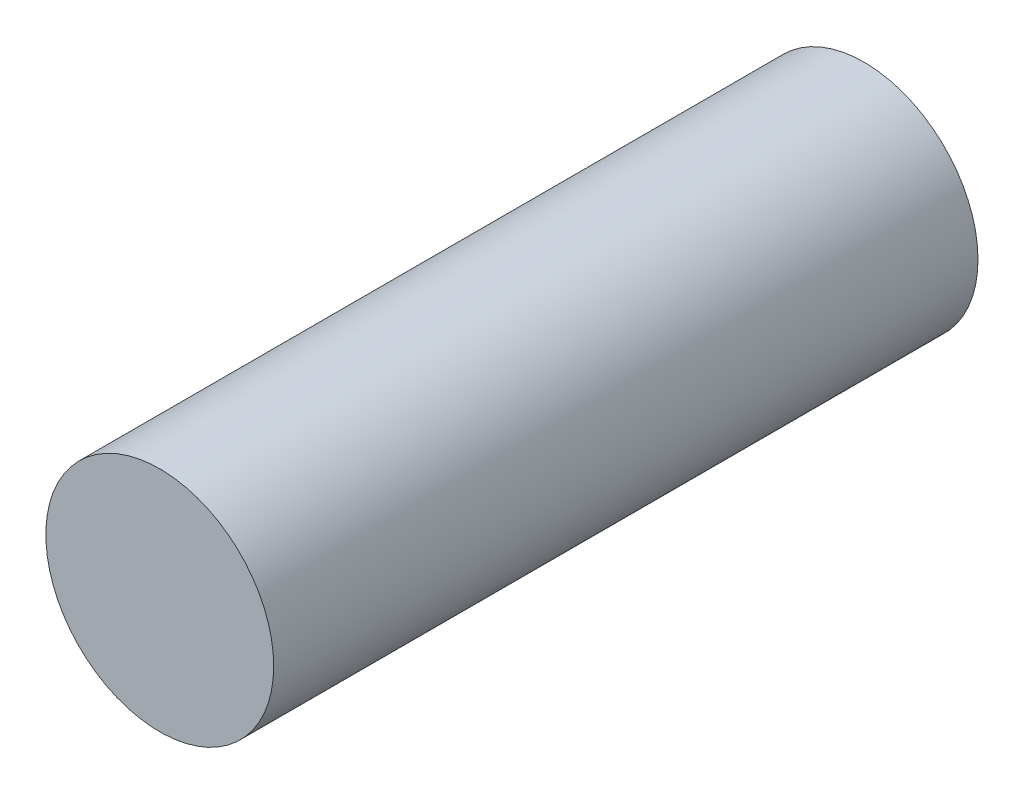
from build123d import *

# Parameters (mm, degrees)
SKETCH1_R           = 11
BOSS_EXTRUDE1_DEPTH = 68


with BuildPart() as part:
    # Sketch1 → Boss-Extrude1 (new body)
    with BuildSketch(Plane.XY):
        Circle(SKETCH1_R)
    extrude(amount=BOSS_EXTRUDE1_DEPTH)


solid = part.part
